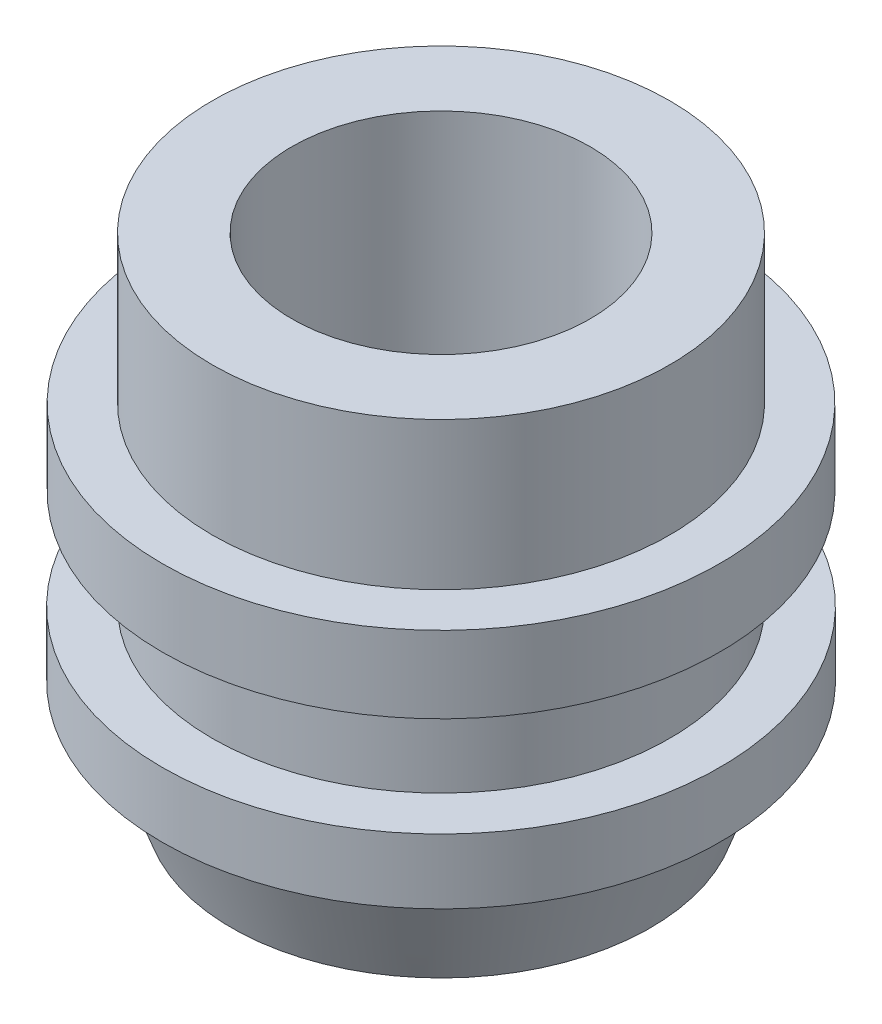
from build123d import *


with BuildPart() as part:
    # 草图2 → 旋转1 (revolve)
    with BuildSketch(Plane(origin=(0, 0, 0), x_dir=(0, 0, -1), z_dir=(1, 0, 0))):
        Polygon((1.5, -0.196247454), (1.5, 4.803752546), (2.3, 4.803752546), (2.3, 3.321830848), (2.8, 3.321830848), (2.8, 2.551231565), (2.3, 2.551231565), (2.3, 1.551231565), (2.80389772, 1.551231565), (2.80389772, 0.899186018), (2.50389772, 0.899186018), (2.105192543, -0.196247454), align=None)
    revolve(axis=Axis((0, 0, 0), (0, 1, 0)))


solid = part.part
